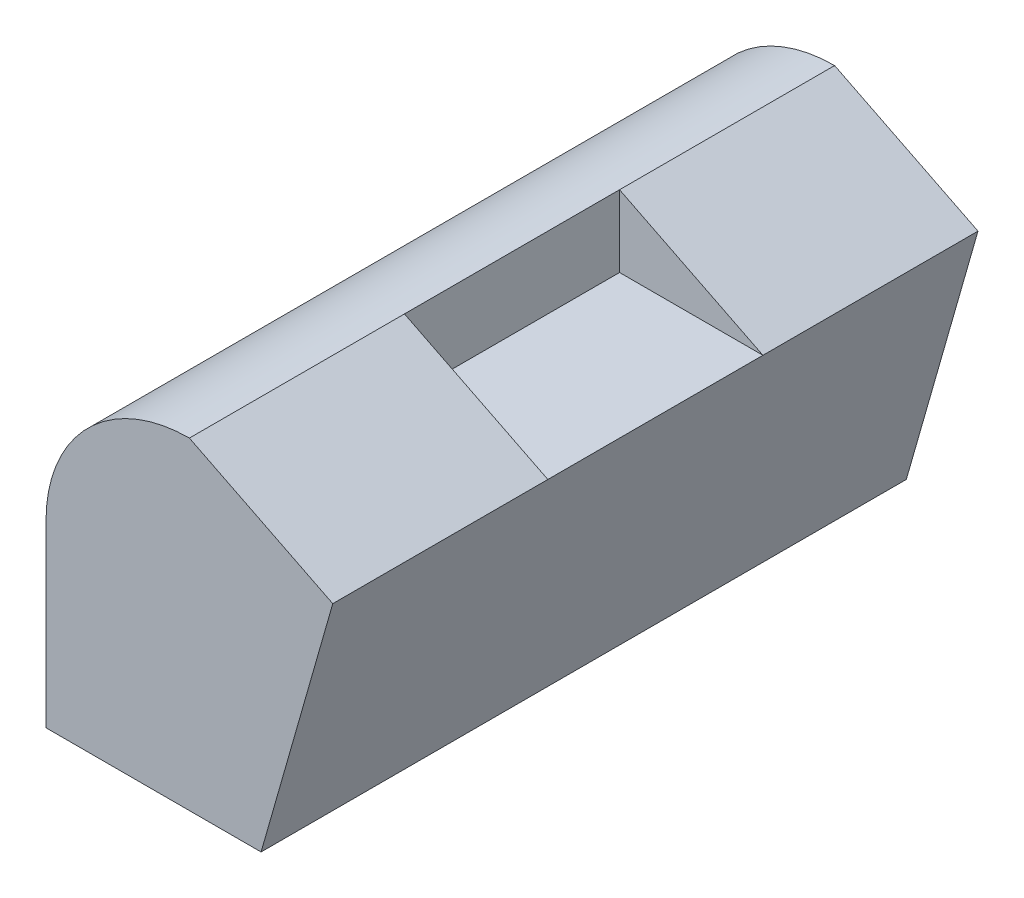
from build123d import *

# Parameters (mm, degrees)
BOSS_EXTRUDE1_DEPTH = 45
CUT_EXTRUDE1_DEPTH  = 15


with BuildPart() as part:
    # Sketch1 → Boss-Extrude1 (new, symmetric)
    with BuildSketch(Plane.XY):
        with BuildLine():
            Line((40, 35), (20, 45))
            ThreePointArc((20, 45), (5.857864376, 39.142135624), (0, 25))
            Line((0, 25), (0, 0))
            Line((0, 0), (30, 0))
            Line((30, 0), (40, 35))
        make_face()
    extrude(amount=BOSS_EXTRUDE1_DEPTH, both=True)

    # Sketch1<3> → Cut-Extrude1 (cut, symmetric)
    with BuildSketch(Plane.XY):
        Polygon((40, 35), (20, 45), (20, 35), align=None)
    extrude(amount=CUT_EXTRUDE1_DEPTH, both=True, mode=Mode.SUBTRACT)


solid = part.part
